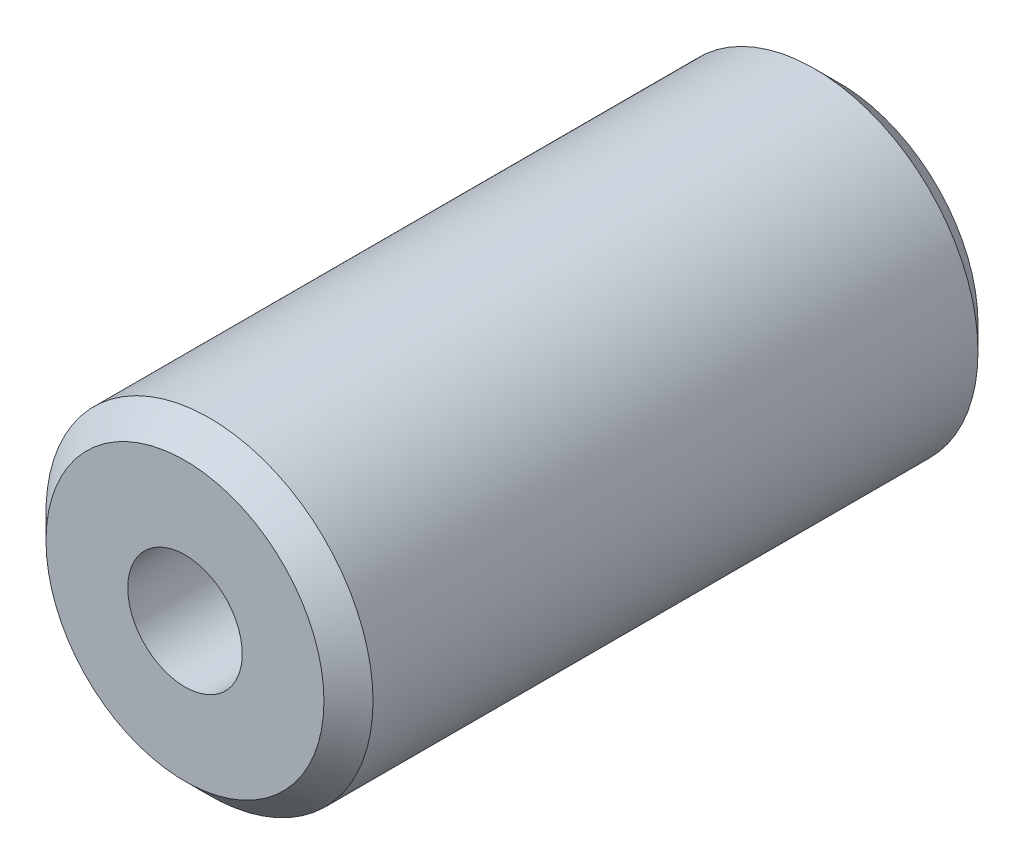
from build123d import *

# Parameters (mm, degrees)
SKETCH1_R           = 10
SKETCH1_R_2         = 3.5
BOSS_EXTRUDE1_DEPTH = 40
CHAMFER1_SIZE       = 1.5
SKETCH2_R           = 6
CUT_EXTRUDE1_DEPTH  = 25
SKETCH3_R           = 2.5
CUT_EXTRUDE2_DEPTH  = 20


with BuildPart() as part:
    # Sketch1 → Boss-Extrude1 (new body)
    with BuildSketch(Plane.XY):
        Circle(SKETCH1_R)
        Circle(SKETCH1_R_2, mode=Mode.SUBTRACT)
    extrude(amount=BOSS_EXTRUDE1_DEPTH)

    # Chamfer1
    chamfer1_edges = [part.edges().sort_by_distance(p)[0] for p in [
        (-10, 0, 0),
        (-10, 0, 40),
    ]]
    chamfer(chamfer1_edges, length=CHAMFER1_SIZE)

    # Sketch2 → Cut-Extrude1 (cut)
    with BuildSketch(Plane(origin=(0, 0, 0), x_dir=(-1, 0, 0), z_dir=(0, 0, -1))):
        Circle(SKETCH2_R)
    extrude(amount=-CUT_EXTRUDE1_DEPTH, mode=Mode.SUBTRACT)

    # Sketch3 → Cut-Extrude2 (cut)
    with BuildSketch(Plane(origin=(0, 0, 0), x_dir=(1, 0, 0), z_dir=(0, 1, 0))):
        with Locations(Location((0, -10, 0), (0, 0, 270))):
            Circle(SKETCH3_R)
        with Locations(Location((0, -30, 0), (0, 0, 270))):
            Circle(SKETCH3_R)
    extrude(amount=-CUT_EXTRUDE2_DEPTH, mode=Mode.SUBTRACT)


solid = part.part
